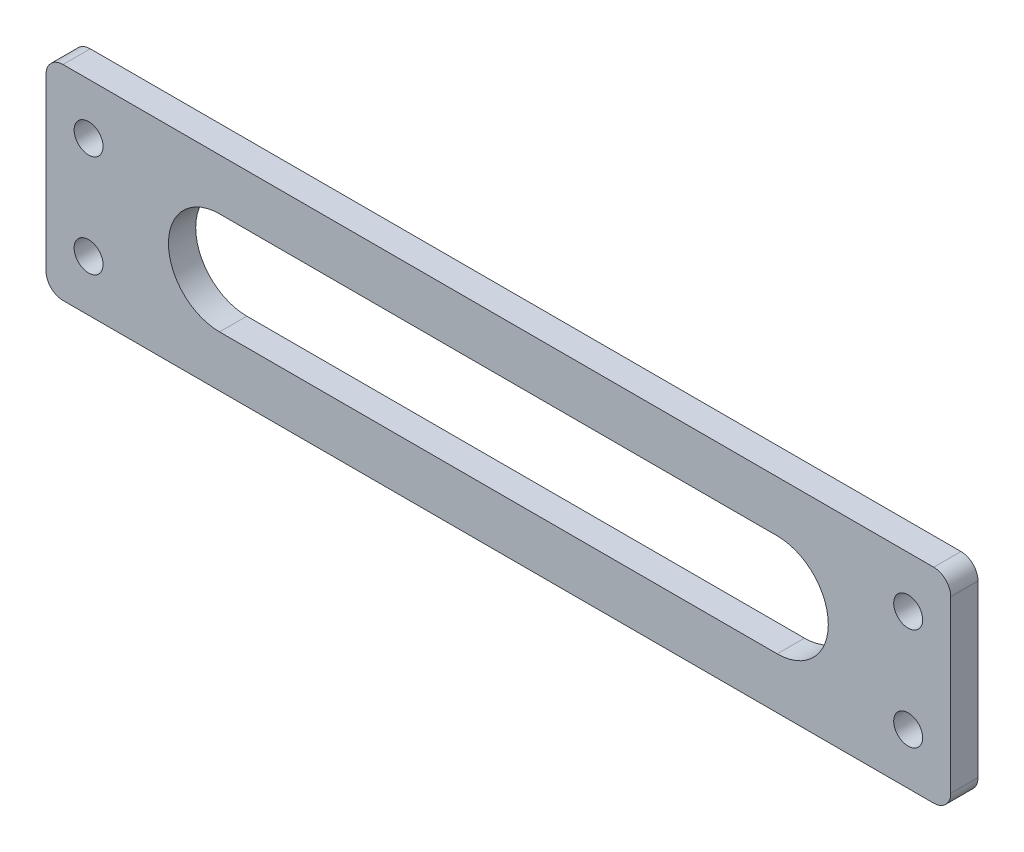
from build123d import *

# Parameters (mm, degrees)
SKETCH_1_W          = 48.12
SKETCH_1_H          = 12
SKETCH_1_R          = 0.85
SKETCH_1_W_2        = 5
EXTRUDE_1_DEPTH     = 1.6
CUT_EXTRUDE_1_DEPTH = 1.6
FILLET_1_R          = 1


with BuildPart() as part:
    # 草图1 → 凸台-拉伸1 (new body)
    # profile 1 of 2: a face of its own
    with BuildSketch(Plane.XY):
        with Locations((29.06, -6)):
            Rectangle(SKETCH_1_W, SKETCH_1_H)
        with Locations((50.62, -9)):
            Circle(SKETCH_1_R, mode=Mode.SUBTRACT)
        with Locations((50.62, -3)):
            Circle(SKETCH_1_R, mode=Mode.SUBTRACT)
    # profile 2 of 2: a face of its own
    with BuildSketch(Plane.XY):
        with Locations((2.5, -6)):
            Rectangle(SKETCH_1_W_2, SKETCH_1_H)
        with Locations((2.5, -9)):
            Circle(SKETCH_1_R, mode=Mode.SUBTRACT)
        with Locations((2.5, -3)):
            Circle(SKETCH_1_R, mode=Mode.SUBTRACT)
    extrude(amount=EXTRUDE_1_DEPTH)

    # 草图2 → 切除-拉伸1 (cut)
    with BuildSketch(Plane(origin=(0, 0, 0), x_dir=(-1, 0, 0), z_dir=(0, 0, -1))):
        with BuildLine():
            Line((-42.930819808, -3), (-10.189180192, -3))
            ThreePointArc((-10.189180192, -3), (-7.189180192, -6), (-10.189180192, -9))
            Line((-10.189180192, -9), (-42.930819808, -9))
            ThreePointArc((-42.930819808, -9), (-45.930819808, -6), (-42.930819808, -3))
        make_face()
    extrude(amount=-CUT_EXTRUDE_1_DEPTH, mode=Mode.SUBTRACT)

    # 圆角1
    fillet_1_edges = [part.edges().sort_by_distance(p)[0] for p in [
        (53.12, -12, 0.8),
        (0, -12, 0.8),
        (0, 0, 0.8),
        (53.12, 0, 0.8),
    ]]
    fillet(fillet_1_edges, radius=FILLET_1_R)


solid = part.part
